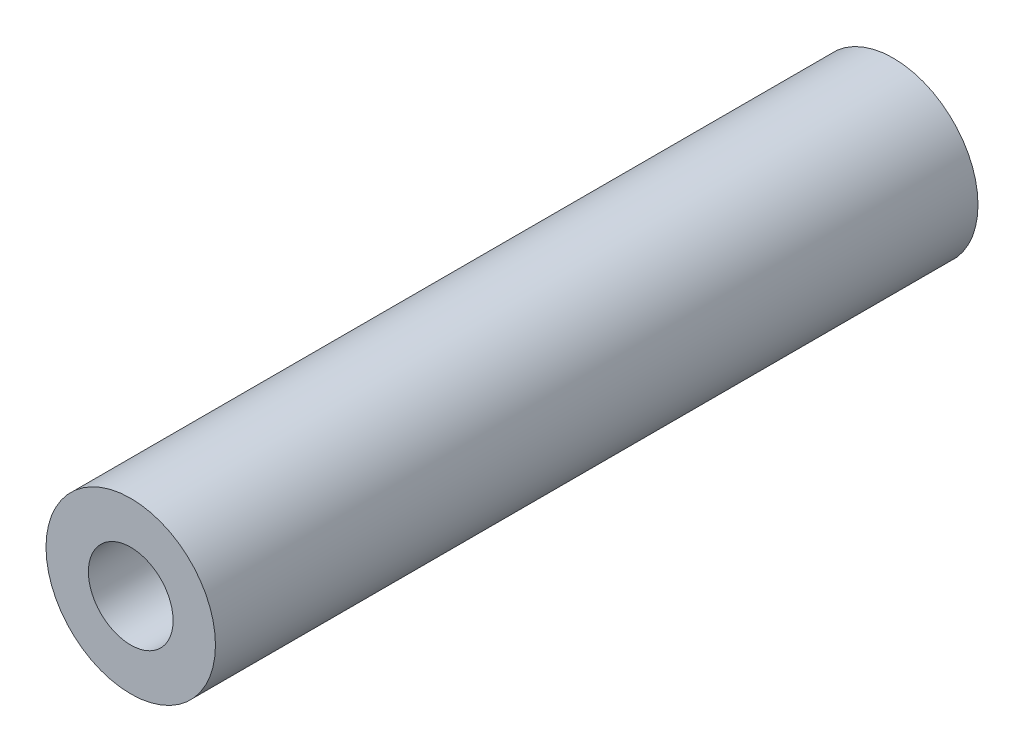
from build123d import *

# Parameters (mm, degrees)
SKETCH1_R           = 25.4
SKETCH1_R_2         = 12.7
BOSS_EXTRUDE1_DEPTH = 228.6


with BuildPart() as part:
    # Sketch1 → Boss-Extrude1 (new body)
    with BuildSketch(Plane.XY):
        Circle(SKETCH1_R)
        Circle(SKETCH1_R_2, mode=Mode.SUBTRACT)
    extrude(amount=BOSS_EXTRUDE1_DEPTH)


solid = part.part
